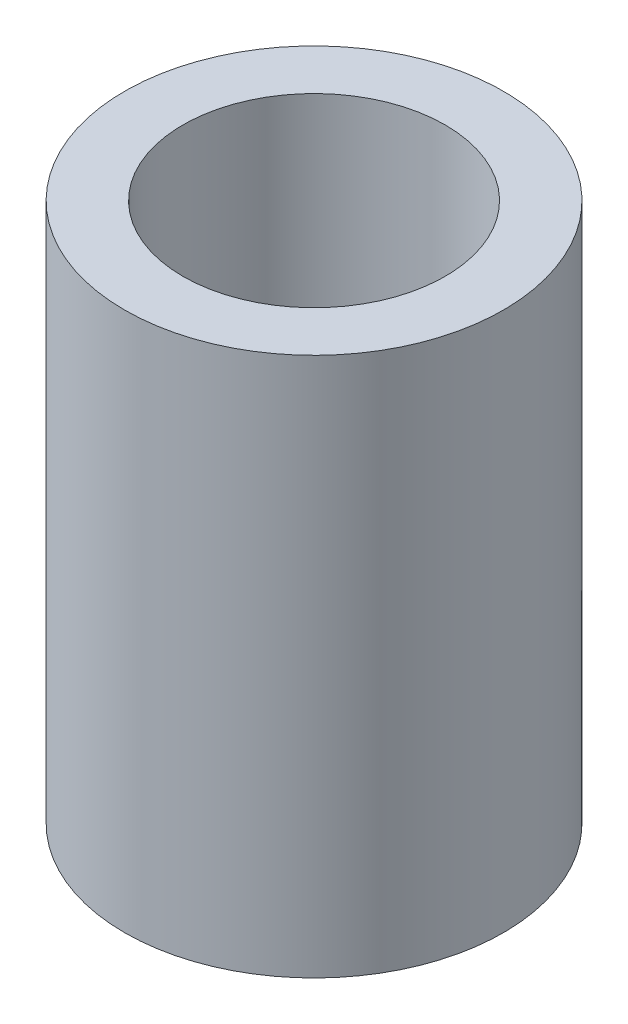
from build123d import *

# Parameters (mm, degrees)
CROQUIS1_R              = 6.5
CROQUIS1_R_2            = 4.5
SALIENTE_EXTRUIR1_DEPTH = 18.5


with BuildPart() as part:
    # Croquis1 → Saliente-Extruir1 (new body)
    with BuildSketch(Plane(origin=(0, 0, 0), x_dir=(1, 0, 0), z_dir=(0, 1, 0))):
        with Locations(Location((0, 0, 0), (0, 0, 270))):
            Circle(CROQUIS1_R)
        with Locations(Location((0, 0, 0), (0, 0, 270))):
            Circle(CROQUIS1_R_2, mode=Mode.SUBTRACT)
    extrude(amount=SALIENTE_EXTRUIR1_DEPTH)


solid = part.part
